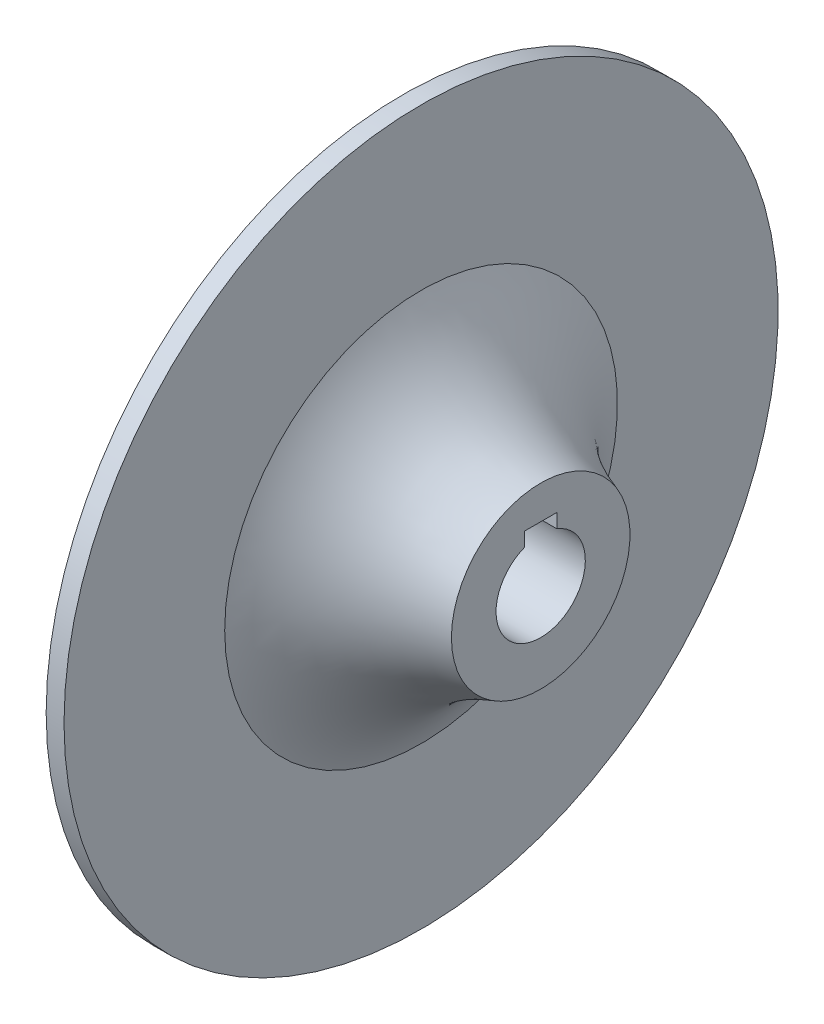
from build123d import *

# Parameters (mm, degrees)
SKETCH1_W           = 2.5
SKETCH1_H           = 22.5
BOSS_EXTRUDE1_DEPTH = 14
CUT_EXTRUDE2_DEPTH  = 23.25
SKETCH6_R           = 2.25
CUT_EXTRUDE3_DEPTH  = 75.434954826
SKETCH7_R           = 50
SKETCH7_R_2         = 12.65
CUT_EXTRUDE6_DEPTH  = 74.284121745


with BuildPart() as part:
    # Sketch1 → Revolve1 (revolve)
    with BuildSketch(Plane.XY, mode=Mode.PRIVATE) as revolve1_sk:
        Polygon((0, 12.65), (0, 0), (19.25, 0), (19.25, 9.144072085), (9.207200807, 18.137623601), (-1.247452839, 27.5), (-3, 27.5), (-3, 12.65), align=None)
        with BuildLine():
            Line((-1.247452839, 27.5), (9.207200807, 18.137623601))
            ThreePointArc((9.207200807, 18.137623601), (5.339394973, 22.45043534), (2.5, 27.5))
            Line((2.5, 27.5), (0, 27.5))
            Line((0, 27.5), (-1.247452839, 27.5))
        make_face()
        with BuildLine():
            Line((9.207200807, 18.137623601), (19.25, 9.144072085))
            Line((19.25, 9.144072085), (19.25, 12.5))
            ThreePointArc((19.25, 12.5), (13.918967856, 14.767235866), (9.207200807, 18.137623601))
        make_face()
        with Locations((1.25, 38.75)):
            Rectangle(SKETCH1_W, SKETCH1_H)
    revolve(revolve1_sk.sketch.rotate(Axis((-75.117650177, 0, 0), (1, 0, 0)), 90), axis=Axis((-75.117650177, 0, 0), (1, 0, 0)))

    # Sketch3 → Boss-Extrude1 (add)
    with BuildSketch(Plane.ZY):
        with BuildLine():
            Line((-2.4, 8.8), (-2.4, 6.469157596))
            ThreePointArc((-2.4, 6.469157596), (0, 6.9), (2.4, 6.469157596))
            Line((2.4, 6.469157596), (2.4, 8.8))
            Line((2.4, 8.8), (-2.4, 8.8))
        make_face()
        with BuildLine():
            Line((-2.4, 6.469157596), (-2.4, 0))
            Line((-2.4, 0), (2.4, 0))
            Line((2.4, 0), (2.4, 6.469157596))
            ThreePointArc((2.4, 6.469157596), (0, 6.9), (-2.4, 6.469157596))
        make_face()
        with BuildLine():
            Line((2.4, 0), (-2.4, 0))
            Line((-2.4, 0), (-2.4, 6.469157596))
            ThreePointArc((-2.4, 6.469157596), (-3.940177661, -5.664362277), (6.9, 0))
            ThreePointArc((6.9, 0), (5.664362277, 3.940177661), (2.4, 6.469157596))
            Line((2.4, 6.469157596), (2.4, 0))
        make_face()
    extrude(amount=BOSS_EXTRUDE1_DEPTH)

    # Sketch5 → Cut-Extrude2 (cut)
    with BuildSketch(Plane(origin=(19.25, 0, 0), x_dir=(0, 0, -1), z_dir=(1, 0, 0))):
        with BuildLine():
            Line((2.25, 7.8), (-2.25, 7.8))
            Line((-2.25, 7.8), (-2.25, 5.830951895))
            ThreePointArc((-2.25, 5.830951895), (0, 6.25), (2.25, 5.830951895))
            Line((2.25, 5.830951895), (2.25, 7.8))
        make_face()
        with BuildLine():
            ThreePointArc((2.25, 5.830951895), (0, 6.25), (-2.25, 5.830951895))
            Line((-2.25, 5.830951895), (-2.25, 0))
            Line((-2.25, 0), (2.25, 0))
            Line((2.25, 0), (2.25, 5.830951895))
        make_face()
        with BuildLine():
            Line((-2.25, 0), (-2.25, 5.830951895))
            ThreePointArc((-2.25, 5.830951895), (-3.535533906, -5.153882032), (6.25, 0))
            ThreePointArc((6.25, 0), (5.153882032, 3.535533906), (2.25, 5.830951895))
            Line((2.25, 5.830951895), (2.25, 0))
            Line((2.25, 0), (-2.25, 0))
        make_face()
    extrude(amount=-CUT_EXTRUDE2_DEPTH, mode=Mode.SUBTRACT)

    # Sketch6 → Cut-Extrude3 (cut, through all)
    with BuildSketch(Plane(origin=(-4, 0, 0), x_dir=(0, 0, -1), z_dir=(1, 0, 0))):
        Circle(SKETCH6_R)
    extrude(amount=-CUT_EXTRUDE3_DEPTH, mode=Mode.SUBTRACT)

    # Sketch7 → Cut-Extrude6 (cut, through all)
    with BuildSketch(Plane.ZY):
        Circle(SKETCH7_R)
        Circle(SKETCH7_R_2, mode=Mode.SUBTRACT)
    extrude(amount=CUT_EXTRUDE6_DEPTH, mode=Mode.SUBTRACT)


solid = part.part
